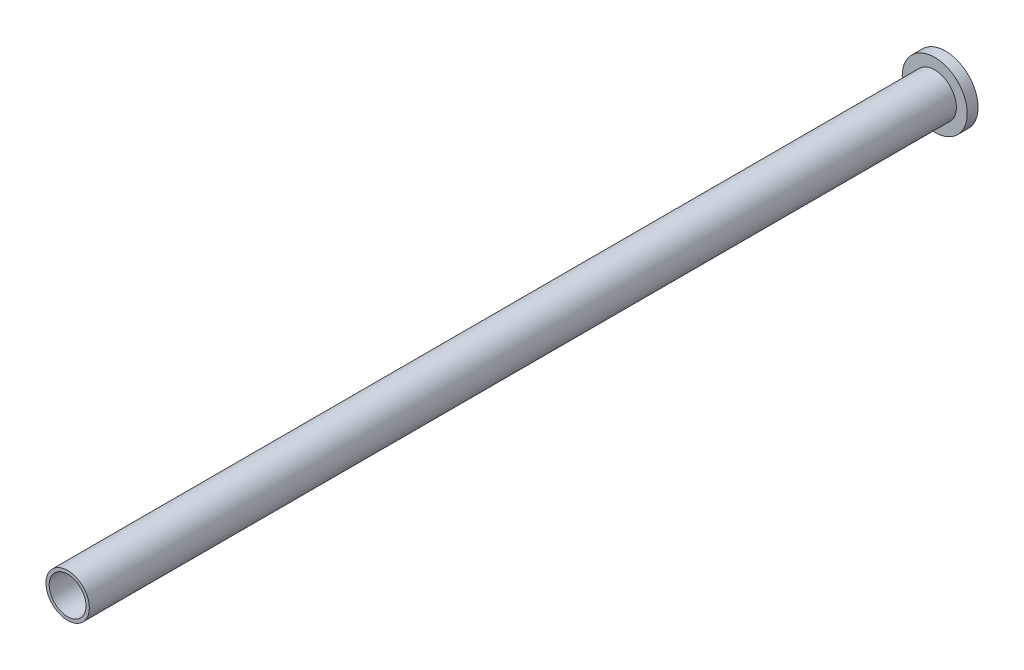
from build123d import *

# Parameters (mm, degrees)
BOSS_EXTRUDE1_DEPTH      = 400
BOSS_EXTRUDE1_DEPTH_BACK = 400
SKETCH3_R                = 20
SKETCH3_R_2              = 17
SKETCH7_R                = 30
BOSS_EXTRUDE4_DEPTH      = 10


with BuildPart() as part:
    # Sketch3 → Boss-Extrude1 (new, two sides: drawn at the far end of the back side and taken through both)
    with BuildSketch(Plane.XY.offset(-BOSS_EXTRUDE1_DEPTH_BACK)):
        Circle(SKETCH3_R)
        Circle(SKETCH3_R_2, mode=Mode.SUBTRACT)
    extrude(amount=BOSS_EXTRUDE1_DEPTH + BOSS_EXTRUDE1_DEPTH_BACK)

    # Sketch7 → Boss-Extrude4 (add)
    with BuildSketch(Plane(origin=(0, 0, -400), x_dir=(-1, 0, 0), z_dir=(0, 0, -1))):
        Circle(SKETCH7_R)
    extrude(amount=BOSS_EXTRUDE4_DEPTH)


solid = part.part
